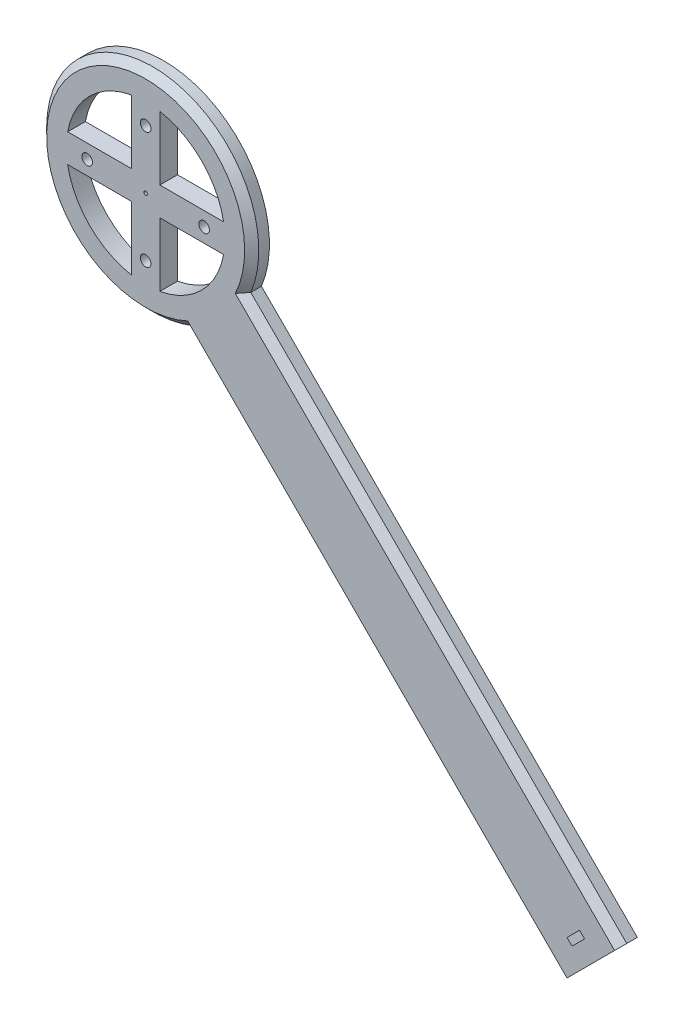
from build123d import *

# Parameters (mm, degrees)
BOSS_EXTRU_1_DEPTH      = 5
ESQUISSE3_R             = 1.5
ESQUISSE3_R_2           = 0.5
ENL_V_MAT_EXTRU_1_DEPTH = 5
ESQUISSE7_W             = 5
ESQUISSE7_H             = 23
ESQUISSE7_H_2           = 5
BOSS_EXTRU_2_DEPTH      = 146
CHANFREIN1_SIZE         = 2
ENL_V_MAT_EXTRU_2_DEPTH = 146


with BuildPart() as part:
    # Esquisse6 → Boss.-Extru.1 (new body)
    with BuildSketch(Plane.XY):
        with BuildLine():
            Line((11.409894089, -29.143009992), (117.475911267, -135.20902717))
            Line((117.475911267, -135.20902717), (133.739367234, -118.945571203))
            Line((133.739367234, -118.945571203), (27.673350056, -12.879554025))
            ThreePointArc((27.673350056, -12.879554025), (-21.166010329, 19.696350392), (11.409894089, -29.143009992))
        make_face()
        with BuildLine():
            Line((-4, -23.469659936), (-4, -5.469659936))
            Line((-4, -5.469659936), (-22, -5.469659936))
            ThreePointArc((-22, -5.469659936), (-15.811388301, -17.281048237), (-4, -23.469659936))
        make_face(mode=Mode.SUBTRACT)
        with BuildLine():
            Line((-4, 2.530340064), (-4, 20.530340064))
            ThreePointArc((-4, 20.530340064), (-15.811388301, 14.341728365), (-22, 2.530340064))
            Line((-22, 2.530340064), (-4, 2.530340064))
        make_face(mode=Mode.SUBTRACT)
        with BuildLine():
            Line((4, 2.530340064), (22, 2.530340064))
            ThreePointArc((22, 2.530340064), (15.811388301, 14.341728365), (4, 20.530340064))
            Line((4, 20.530340064), (4, 2.530340064))
        make_face(mode=Mode.SUBTRACT)
        with BuildLine():
            Line((4, -5.469659936), (4, -23.469659936))
            ThreePointArc((4, -23.469659936), (15.811388301, -17.281048237), (22, -5.469659936))
            Line((22, -5.469659936), (4, -5.469659936))
        make_face(mode=Mode.SUBTRACT)
    extrude(amount=BOSS_EXTRU_1_DEPTH)

    # Esquisse3 → Enlèv. mat.-Extru.1 (cut)
    with BuildSketch(Plane.XY):
        with Locations((0, 15.030340064)):
            Circle(ESQUISSE3_R)
        with Locations((16.5, -1.469659936)):
            Circle(ESQUISSE3_R)
        with Locations((0, -17.969659936)):
            Circle(ESQUISSE3_R)
        with Locations((-16.5, -1.469659936)):
            Circle(ESQUISSE3_R)
        with Locations((0, -1.469659936)):
            Circle(ESQUISSE3_R_2)
    extrude(amount=ENL_V_MAT_EXTRU_1_DEPTH, mode=Mode.SUBTRACT)

    # Esquisse7 → Boss.-Extru.2 (add)
    with BuildSketch(Plane(origin=(126.342469219, -126.342469219, 0), x_dir=(0, 0, -1), z_dir=(0.7071067811865442, -0.7071067811865508, 0))):
        with Locations((-2.5, -1.039206507)):
            Rectangle(ESQUISSE7_W, ESQUISSE7_H)
        with Locations((2.5, -1.039206507)):
            Rectangle(ESQUISSE7_W, ESQUISSE7_H_2)
    extrude(amount=-BOSS_EXTRU_2_DEPTH)

    # Chanfrein1
    chanfrein1_edges = [part.edges().sort_by_distance(p)[0] for p in [
        (80.706358645, -65.912562614, 5),
        (-21.166010329, 19.696350392, 5),
        (64.442902678, -82.176018581, 5),
    ]]
    chamfer(chanfrein1_edges, length=CHANFREIN1_SIZE)

    # Esquisse8 → Enlèv. mat.-Extru.2 (cut)
    with BuildSketch(Plane.XY.offset(5)):
        Polygon((120.304338392, -125.309532234), (123.839872298, -121.773998328), (122.425658735, -120.359784766), (118.890124829, -123.895318671), align=None)
    extrude(amount=-ENL_V_MAT_EXTRU_2_DEPTH, mode=Mode.SUBTRACT)


solid = part.part
